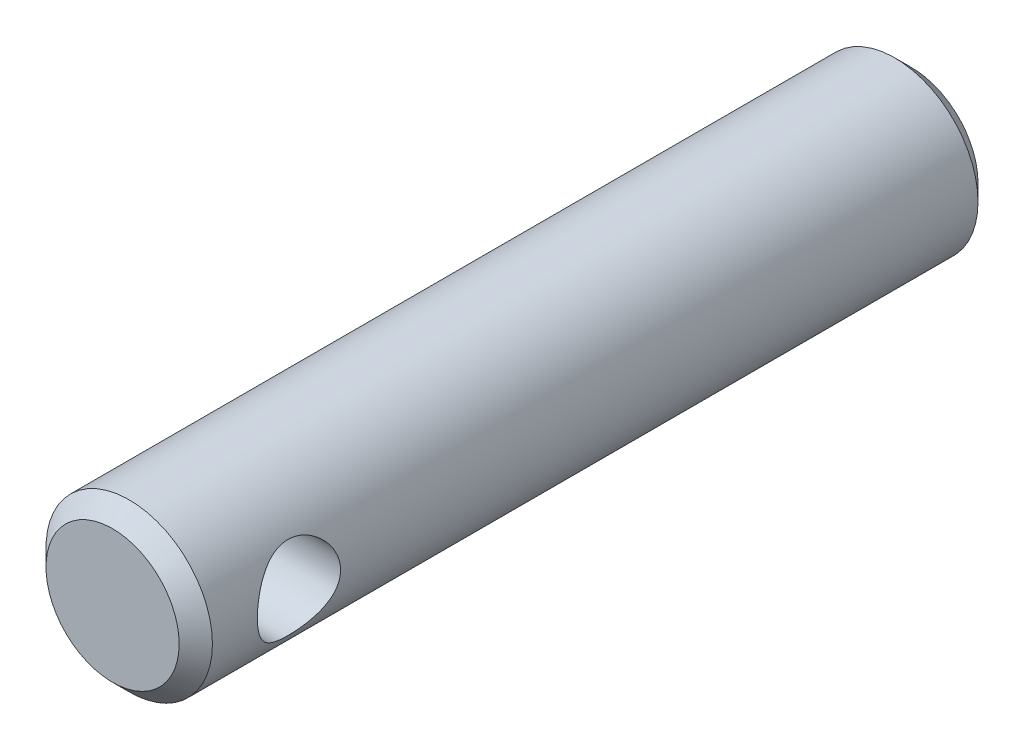
from build123d import *

# Parameters (mm, degrees)
SKETCH_1_R      = 5
EXTRUDE_1_DEPTH = 24
CHAMFER_1_SIZE  = 1
SKETCH_6_W      = 2.5
SKETCH_6_H      = 5


with BuildPart() as part:
    # ｽｹｯﾁ1 → ﾎﾞｽ - 押し出し1 (new, symmetric)
    with BuildSketch(Plane.XY):
        Circle(SKETCH_1_R)
    extrude(amount=EXTRUDE_1_DEPTH, both=True)

    # 面取り1
    chamfer_1_edges = [part.edges().sort_by_distance(p)[0] for p in [
        (-5, 0, -24),
        (-5, 0, 24),
    ]]
    chamfer(chamfer_1_edges, length=CHAMFER_1_SIZE)

    # ｽｹｯﾁ6 → M6x1.0 ねじ穴用ねじ下穴ﾄﾞﾘﾙ1 (revolve, cut)
    with BuildSketch(Plane(origin=(0, 0, 17.8), x_dir=(0, 0, 1), z_dir=(0, 1, 0))):
        with Locations((1.25, 2.5)):
            Rectangle(SKETCH_6_W, SKETCH_6_H)
    m6x1_0_1 = revolve(axis=Axis((-6.35, 0, 17.8), (1, 0, 0)), mode=Mode.SUBTRACT)

    # ﾐﾗｰ1: M6x1.0 ねじ穴用ねじ下穴ﾄﾞﾘﾙ1 across plane
    add(m6x1_0_1.mirror(Plane(origin=(0, 0, 0), x_dir=(0, 0, 1), z_dir=(1, 0, 0))), mode=Mode.SUBTRACT)


solid = part.part
